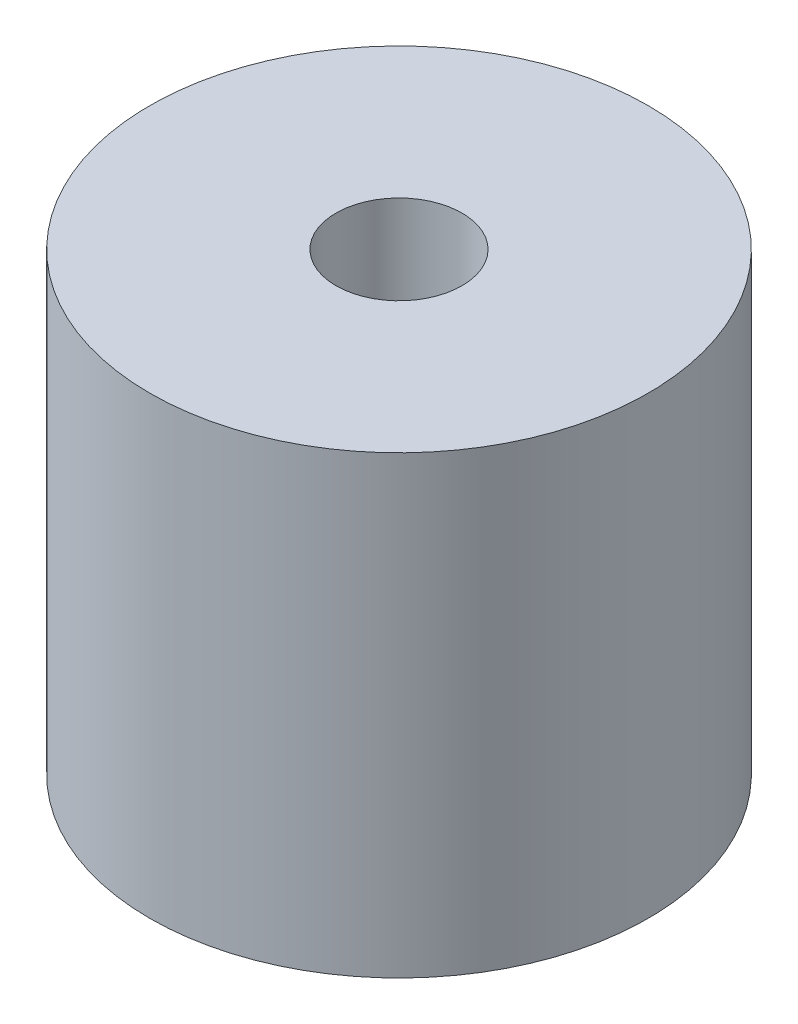
from build123d import *

# Parameters (mm, degrees)
SKETCH1_R               = 8.89
BOSS_EXTRUDE1_DEPTH     = 8.1153
CUT_EXTRUDE1_DEPTH      = 21.530381788
CUT_EXTRUDE1_DEPTH_BACK = 21.530381788
SKETCH2_R               = 2.2479


with BuildPart() as part:
    # Sketch1 → Boss-Extrude1 (new, symmetric)
    with BuildSketch(Plane(origin=(0, 0, 0), x_dir=(1, 0, 0), z_dir=(0, 1, 0))):
        with Locations(Location((0, 0, 0), (0, 0, 270))):
            Circle(SKETCH1_R)
    extrude(amount=BOSS_EXTRUDE1_DEPTH, both=True)

    # Sketch2 → Cut-Extrude1 (cut, two sides: drawn at the far end of the back side and taken through both)
    with BuildSketch(Plane(origin=(0, 8.1153, 0), x_dir=(1, 0, 0), z_dir=(0, 1, 0)).offset(-CUT_EXTRUDE1_DEPTH_BACK)):
        with Locations(Location((0, 0, 0), (0, 0, 270))):
            Circle(SKETCH2_R)
    extrude(amount=CUT_EXTRUDE1_DEPTH + CUT_EXTRUDE1_DEPTH_BACK, mode=Mode.SUBTRACT)


solid = part.part
